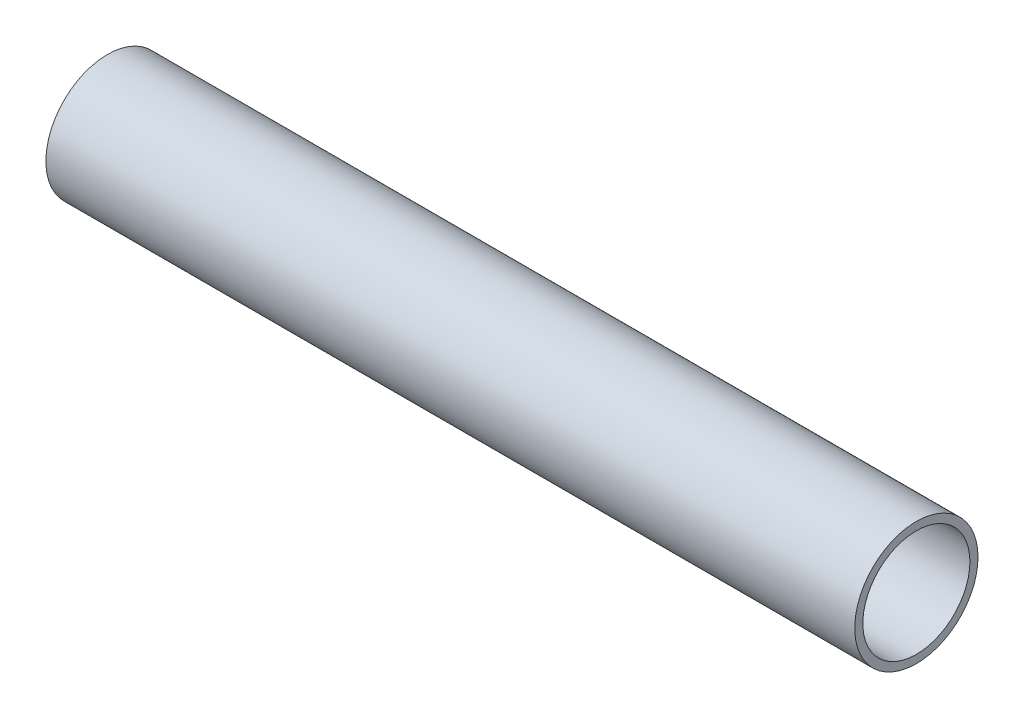
from build123d import *

# Parameters (mm, degrees)
SKETCH1_R           = 76.2
SKETCH1_R_2         = 66.2
BOSS_EXTRUDE1_DEPTH = 1000


with BuildPart() as part:
    # Sketch1 → Boss-Extrude1 (new body)
    with BuildSketch(Plane.YZ):
        with Locations(Location((0, 0, 0), (0, 0, 270))):
            Circle(SKETCH1_R)
        with Locations(Location((0, 0, 0), (0, 0, 270))):
            Circle(SKETCH1_R_2, mode=Mode.SUBTRACT)
    extrude(amount=BOSS_EXTRUDE1_DEPTH)


solid = part.part
